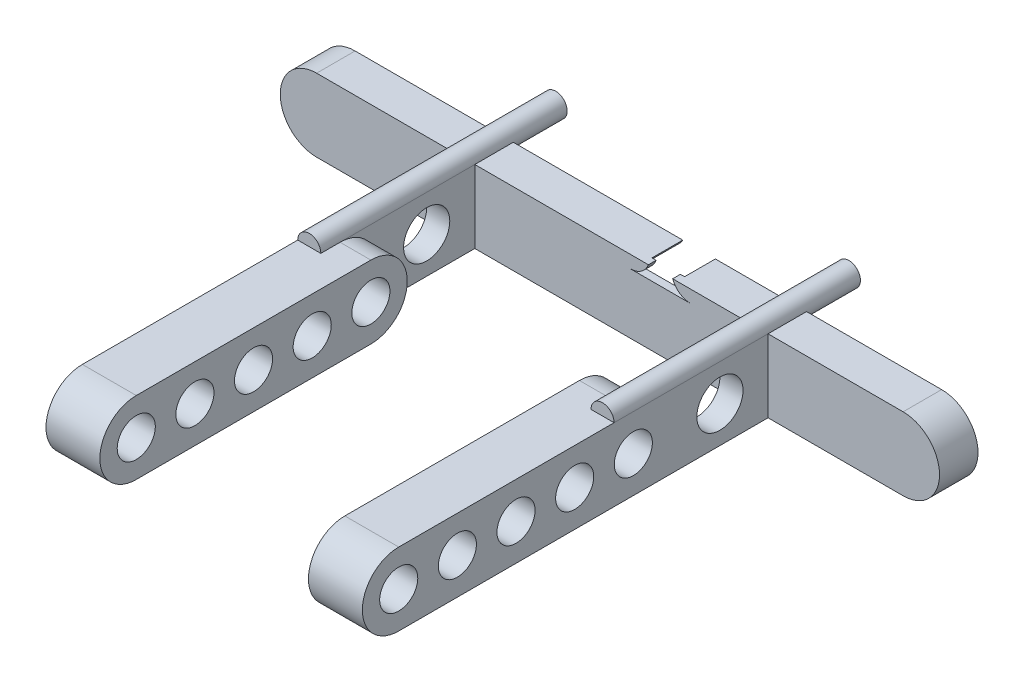
from build123d import *

# Parameters (mm, degrees)
EXTRUDE_1_DEPTH          = 2
EXTRUDE_START            = -24
SKETCH_2_R               = 3
EXTRUDE_2_DEPTH          = 24
EXTRUDE_START_2          = 8
EXTRUDE_3_DEPTH          = 8
SKETCH_5_W               = 143.526768474
SKETCH_5_H               = 22.779611496
CUT_EXTRUDE_1_DEPTH      = 90.927438057
EXTRUDE_4_DEPTH          = 50
SKETCH_7_R               = 6
CUT_EXTRUDE_2_DEPTH      = 138.469699072
SKETCH_8_W               = 162.700191743
SKETCH_8_H               = 85.823894635
CUT_EXTRUDE_3_DEPTH      = 10
SKETCH_9_R               = 4.95
EXTRUDE_5_DEPTH          = 14
EXTRUDE_START_3          = -14
SKETCH_10_R              = 4.95
EXTRUDE_6_DEPTH          = 14
CUT_EXTRUDE_4_DEPTH      = 157.127849217
CUT_EXTRUDE_4_DEPTH_BACK = 157.127849217
SKETCH_11_R              = 4.95


with BuildPart() as part:
    # Эскиз1 → Бобышка-Вытянуть1 (new body)
    with BuildSketch(Plane.XY):
        with BuildLine():
            Line((20.999794095, 5.325), (5.329794095, 5.325))
            ThreePointArc((5.329794095, 5.325), (8.180232657, 6.217080819), (10.013542594, 8.575))
            Line((10.013542594, 8.575), (-35.092602953, 8.575))
            ThreePointArc((-35.092602953, 8.575), (-38.092602953, 5.575), (-41.092602953, 8.575))
            Line((-41.092602953, 8.575), (-76.185205905, 8.575))
            ThreePointArc((-76.185205905, 8.575), (-85.635205905, -0.875), (-76.185205905, -10.325))
            Line((-76.185205905, -10.325), (-41.092602953, -10.325))
            ThreePointArc((-41.092602953, -10.325), (-38.092602953, -7.325), (-35.092602953, -10.325))
            Line((-35.092602953, -10.325), (35.092602953, -10.325))
            ThreePointArc((35.092602953, -10.325), (38.092602953, -7.325), (41.092602953, -10.325))
            Line((41.092602953, -10.325), (76.185205905, -10.325))
            ThreePointArc((76.185205905, -10.325), (85.635205905, -0.875), (76.185205905, 8.575))
            Line((76.185205905, 8.575), (41.092602953, 8.575))
            ThreePointArc((41.092602953, 8.575), (38.092602953, 5.575), (35.092602953, 8.575))
            Line((35.092602953, 8.575), (16.316045596, 8.575))
            ThreePointArc((16.316045596, 8.575), (18.149355532, 6.217080819), (20.999794095, 5.325))
        make_face()
    extrude(amount=EXTRUDE_1_DEPTH)

    # Эскиз2 → Бобышка-Вытянуть2 (add)
    with BuildSketch(Plane.XY.offset(2).offset(EXTRUDE_START)):
        with Locations(Location((38.092602953, 8.575, 0), (0, 0, 180))):
            Circle(SKETCH_2_R)
        with Locations(Location((38.092602953, -10.325, 0), (0, 0, 180))):
            Circle(SKETCH_2_R)
        with Locations(Location((-38.092602953, -10.325, 0), (0, 0, 180))):
            Circle(SKETCH_2_R)
        with Locations(Location((-38.092602953, 8.575, 0), (0, 0, 180))):
            Circle(SKETCH_2_R)
    extrude(amount=EXTRUDE_2_DEPTH)

    # Эскиз4 → Бобышка-Вытянуть3 (add)
    with BuildSketch(Plane(origin=(0, 0, 0), x_dir=(-1, 0, 0), z_dir=(0, 0, -1)).offset(EXTRUDE_START_2)):
        with BuildLine():
            Line((-17.402920452, 8.575), (-35.092602953, 8.575))
            ThreePointArc((-35.092602953, 8.575), (-38.092602953, 5.575), (-41.092602953, 8.575))
            Line((-41.092602953, 8.575), (-76.185205905, 8.575))
            ThreePointArc((-76.185205905, 8.575), (-85.635205905, -0.875), (-76.185205905, -10.325))
            Line((-76.185205905, -10.325), (-41.092602953, -10.325))
            ThreePointArc((-41.092602953, -10.325), (-38.092602953, -7.325), (-35.092602953, -10.325))
            Line((-35.092602953, -10.325), (35.092602953, -10.325))
            ThreePointArc((35.092602953, -10.325), (38.092602953, -7.325), (41.092602953, -10.325))
            Line((41.092602953, -10.325), (76.185205905, -10.325))
            ThreePointArc((76.185205905, -10.325), (85.635205905, -0.875), (76.185205905, 8.575))
            Line((76.185205905, 8.575), (41.092602953, 8.575))
            ThreePointArc((41.092602953, 8.575), (38.092602953, 5.575), (35.092602953, 8.575))
            Line((35.092602953, 8.575), (-8.926667737, 8.575))
            ThreePointArc((-8.926667737, 8.575), (-7.451114438, 6.933835008), (-5.329794095, 6.325))
            Line((-5.329794095, 6.325), (30.474082362, 6.325))
            ThreePointArc((30.474082362, 6.325), (37.674082362, -0.875), (30.474082362, -8.075))
            Line((30.474082362, -8.075), (-30.474082362, -8.075))
            ThreePointArc((-30.474082362, -8.075), (-37.674082362, -0.875), (-30.474082362, 6.325))
            Line((-30.474082362, 6.325), (-20.999794095, 6.325))
            ThreePointArc((-20.999794095, 6.325), (-18.878473751, 6.933835008), (-17.402920452, 8.575))
        make_face()
        with BuildLine():
            Line((-45.711123543, 6.325), (-76.185205905, 6.325))
            ThreePointArc((-76.185205905, 6.325), (-83.385205905, -0.875), (-76.185205905, -8.075))
            Line((-76.185205905, -8.075), (-45.711123543, -8.075))
            ThreePointArc((-45.711123543, -8.075), (-38.511123543, -0.875), (-45.711123543, 6.325))
        make_face(mode=Mode.SUBTRACT)
        with BuildLine():
            Line((76.185205905, 6.325), (45.711123543, 6.325))
            ThreePointArc((45.711123543, 6.325), (38.511123543, -0.875), (45.711123543, -8.075))
            Line((45.711123543, -8.075), (76.185205905, -8.075))
            ThreePointArc((76.185205905, -8.075), (83.385205905, -0.875), (76.185205905, 6.325))
        make_face(mode=Mode.SUBTRACT)
    extrude(amount=-EXTRUDE_3_DEPTH)

    # Эскиз5 → Вырез-Вытянуть1 (cut, through all)
    with BuildSketch(Plane.XY.offset(2)):
        with Locations((16.343060787, -21.714805748)):
            Rectangle(SKETCH_5_W, SKETCH_5_H)
    extrude(amount=-CUT_EXTRUDE_1_DEPTH, mode=Mode.SUBTRACT)

    # Эскиз6 → Бобышка-Вытянуть4 (add)
    with BuildSketch(Plane.XY.offset(2)):
        with BuildLine():
            ThreePointArc((-35.092602953, 8.575), (-38.092602953, 11.575), (-41.092602953, 8.575))
            Line((-41.092602953, 8.575), (-41.092602953, -10.325))
            Line((-41.092602953, -10.325), (-35.092602953, -10.325))
            Line((-35.092602953, -10.325), (-35.092602953, 8.575))
        make_face()
        with BuildLine():
            Line((35.092602953, 8.575), (35.092602953, -10.325))
            Line((35.092602953, -10.325), (41.092602953, -10.325))
            Line((41.092602953, -10.325), (41.092602953, 8.575))
            ThreePointArc((41.092602953, 8.575), (38.092602953, 11.575), (35.092602953, 8.575))
        make_face()
    extrude(amount=EXTRUDE_4_DEPTH)

    # Эскиз7 → Вырез-Вытянуть2 (cut, through all)
    with BuildSketch(Plane(origin=(41.092602953, 0, 0), x_dir=(0, 0, -1), z_dir=(1, 0, 0))):
        with Locations(Location((-14.5, -0.875, 0), (0, 0, 90))):
            Circle(SKETCH_7_R)
    extrude(amount=-CUT_EXTRUDE_2_DEPTH, mode=Mode.SUBTRACT)

    # Эскиз8 → Вырез-Вытянуть3 (cut)
    with BuildSketch(Plane.XY.offset(52)):
        with Locations((-1.826040312, 7.472651168)):
            Rectangle(SKETCH_8_W, SKETCH_8_H)
    extrude(amount=-CUT_EXTRUDE_3_DEPTH, mode=Mode.SUBTRACT)

    # Эскиз9 → Бобышка-Вытянуть5 (add)
    with BuildSketch(Plane(origin=(41.092602953, 0, 0), x_dir=(0, 0, -1), z_dir=(1, 0, 0))):
        with BuildLine():
            Line((-97.948164724, 8.575), (-37, 8.575))
            ThreePointArc((-37, 8.575), (-27.55, -0.875), (-37, -10.325))
            Line((-37, -10.325), (-97.948164724, -10.325))
            ThreePointArc((-97.948164724, -10.325), (-107.398164724, -0.875), (-97.948164724, 8.575))
        make_face()
        with Locations(Location((-97.948164724, -0.875, 0), (0, 0, 90))):
            Circle(SKETCH_9_R, mode=Mode.SUBTRACT)
        with Locations(Location((-82.711123543, -0.875, 0), (0, 0, 90))):
            Circle(SKETCH_9_R, mode=Mode.SUBTRACT)
        with Locations(Location((-67.474082362, -0.875, 0), (0, 0, 90))):
            Circle(SKETCH_9_R, mode=Mode.SUBTRACT)
        with Locations(Location((-52.237041181, -0.875, 0), (0, 0, 90))):
            Circle(SKETCH_9_R, mode=Mode.SUBTRACT)
        with Locations(Location((-37, -0.875, 0), (0, 0, 90))):
            Circle(SKETCH_9_R, mode=Mode.SUBTRACT)
    extrude(amount=-EXTRUDE_5_DEPTH)

    # Эскиз10 → Бобышка-Вытянуть6 (add)
    with BuildSketch(Plane.ZY.offset(41.092602953).offset(EXTRUDE_START_3)):
        with BuildLine():
            Line((97.948164724, 8.575), (37, 8.575))
            ThreePointArc((37, 8.575), (27.55, -0.875), (37, -10.325))
            Line((37, -10.325), (97.948164724, -10.325))
            ThreePointArc((97.948164724, -10.325), (107.398164724, -0.875), (97.948164724, 8.575))
        make_face()
        with Locations(Location((52.237041181, -0.875, 0), (0, 0, 90))):
            Circle(SKETCH_10_R, mode=Mode.SUBTRACT)
        with Locations(Location((67.474082362, -0.875, 0), (0, 0, 90))):
            Circle(SKETCH_10_R, mode=Mode.SUBTRACT)
        with Locations(Location((82.711123543, -0.875, 0), (0, 0, 90))):
            Circle(SKETCH_10_R, mode=Mode.SUBTRACT)
        with Locations(Location((97.948164724, -0.875, 0), (0, 0, 90))):
            Circle(SKETCH_10_R, mode=Mode.SUBTRACT)
    extrude(amount=EXTRUDE_6_DEPTH)

    # Эскиз11 → Вырез-Вытянуть4 (cut, two sides: drawn at the far end of the back side and taken through both)
    with BuildSketch(Plane.ZY.offset(-27.092602953).offset(-CUT_EXTRUDE_4_DEPTH_BACK)):
        with Locations(Location((37, -0.875, 0), (0, 0, 90))):
            Circle(SKETCH_11_R)
    extrude(amount=CUT_EXTRUDE_4_DEPTH + CUT_EXTRUDE_4_DEPTH_BACK, mode=Mode.SUBTRACT)


solid = part.part
